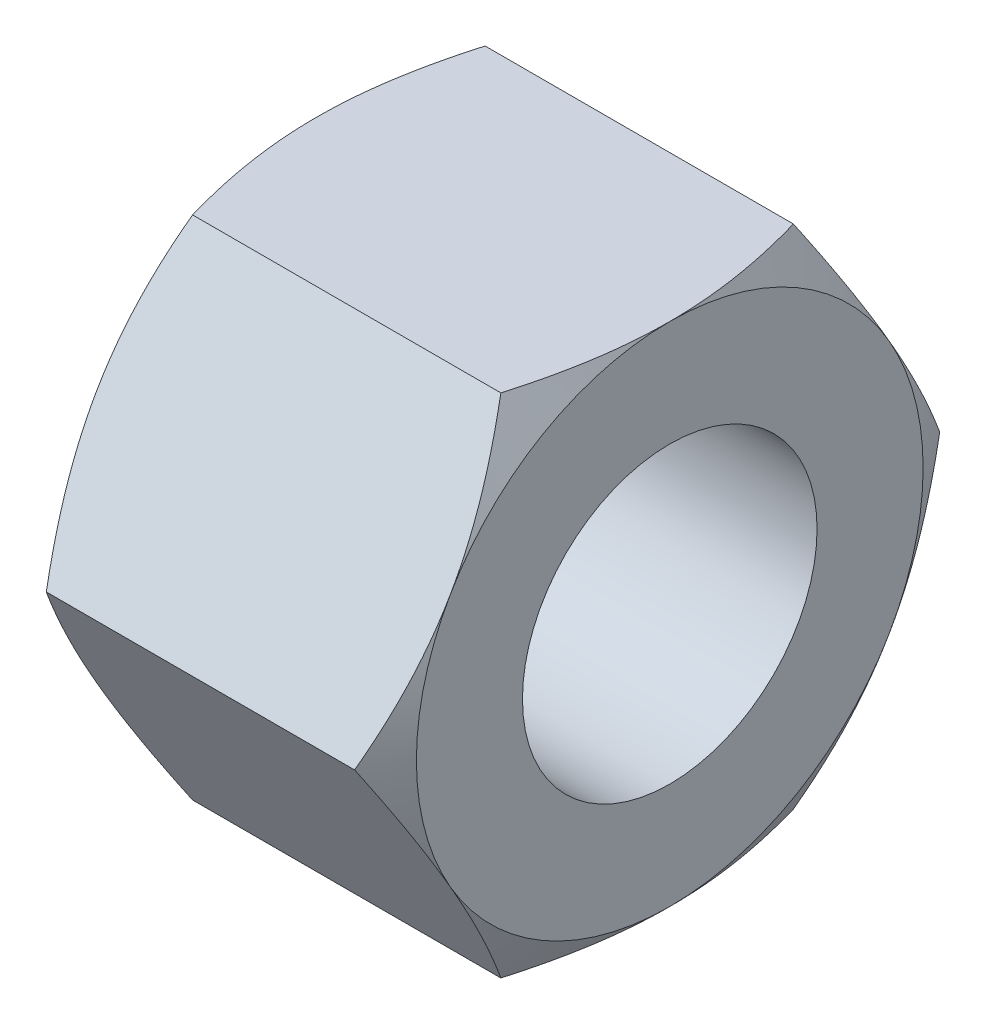
from build123d import *

# Parameters (mm, degrees)
IZIM1_R                     = 1.25
Y_KSEKLIK_EKSTR_ZYON1_DEPTH = 3
IZIM2_OUTSIDE_W             = 43.052
IZIM2_OUTSIDE_H             = 42.386
IZIM2_OUTSIDE_R             = 2.15
KES_EKSTR_ZYON1_DEPTH       = 10
KES_EKSTR_ZYON1_DRAFT       = -60
IZIM3_OUTSIDE_W             = 43.052
IZIM3_OUTSIDE_H             = 42.386
IZIM3_OUTSIDE_R             = 2.15
KES_EKSTR_ZYON2_DEPTH       = 10
KES_EKSTR_ZYON2_DRAFT       = -60


with BuildPart() as part:
    # Çizim1 → Yükseklik-Ekstrüzyon1 (new body)
    with BuildSketch(Plane(origin=(0, 0, 0), x_dir=(0, 0, -1), z_dir=(1, 0, 0))):
        Polygon((2.482606158, 0), (1.241303079, 2.15), (-1.241303079, 2.15), (-2.482606158, 0), (-1.241303079, -2.15), (1.241303079, -2.15), align=None)
        Circle(IZIM1_R, mode=Mode.SUBTRACT)
    extrude(amount=Y_KSEKLIK_EKSTR_ZYON1_DEPTH)


with BuildPart() as kes_ekstr_zyon1_tool:
    # Çizim2 outside → Kes-Ekstrüzyon1 (with draft: the straight prism first)
    with BuildSketch(Plane(origin=(3, 0, 0), x_dir=(0, 0, -1), z_dir=(1, 0, 0))):
        Rectangle(IZIM2_OUTSIDE_W, IZIM2_OUTSIDE_H)
        Circle(IZIM2_OUTSIDE_R, mode=Mode.SUBTRACT)
    extrude(amount=-KES_EKSTR_ZYON1_DEPTH)
    # Kes-Ekstrüzyon1: the draft: its side faces are tilted about the plane it starts from
    kes_ekstr_zyon1_sides = [kes_ekstr_zyon1_tool.faces().sort_by_distance(p)[0] for p in [
        (-2, -21.193, 0),
        (-2, 0, -21.526),
        (-2, 21.193, 0),
        (-2, 0, 21.526),
        (-2, 0, 2.15),
    ]]
    draft(kes_ekstr_zyon1_sides, Plane(origin=(3, 0, 0), x_dir=(0, 0, -1), z_dir=(1, 0, 0)), KES_EKSTR_ZYON1_DRAFT)


with BuildPart() as part_1:
    add(part.part)

    # Kes-Ekstrüzyon1: cut by kes_ekstr_zyon1_tool
    add(kes_ekstr_zyon1_tool.part, mode=Mode.SUBTRACT)


with BuildPart() as kes_ekstr_zyon2_tool:
    # Çizim3 outside → Kes-Ekstrüzyon2 (with draft: the straight prism first)
    with BuildSketch(Plane.ZY):
        Rectangle(IZIM3_OUTSIDE_W, IZIM3_OUTSIDE_H)
        Circle(IZIM3_OUTSIDE_R, mode=Mode.SUBTRACT)
    extrude(amount=-KES_EKSTR_ZYON2_DEPTH)
    # Kes-Ekstrüzyon2: the draft: its side faces are tilted about the plane it starts from
    kes_ekstr_zyon2_sides = [kes_ekstr_zyon2_tool.faces().sort_by_distance(p)[0] for p in [
        (5, -21.193, 0),
        (5, 0, 21.526),
        (5, 21.193, 0),
        (5, 0, -21.526),
        (5, 0, -2.15),
    ]]
    draft(kes_ekstr_zyon2_sides, Plane.ZY, KES_EKSTR_ZYON2_DRAFT)


with BuildPart() as part_2:
    add(part_1.part)

    # Kes-Ekstrüzyon2: cut by kes_ekstr_zyon2_tool
    add(kes_ekstr_zyon2_tool.part, mode=Mode.SUBTRACT)


solid = part_2.part
